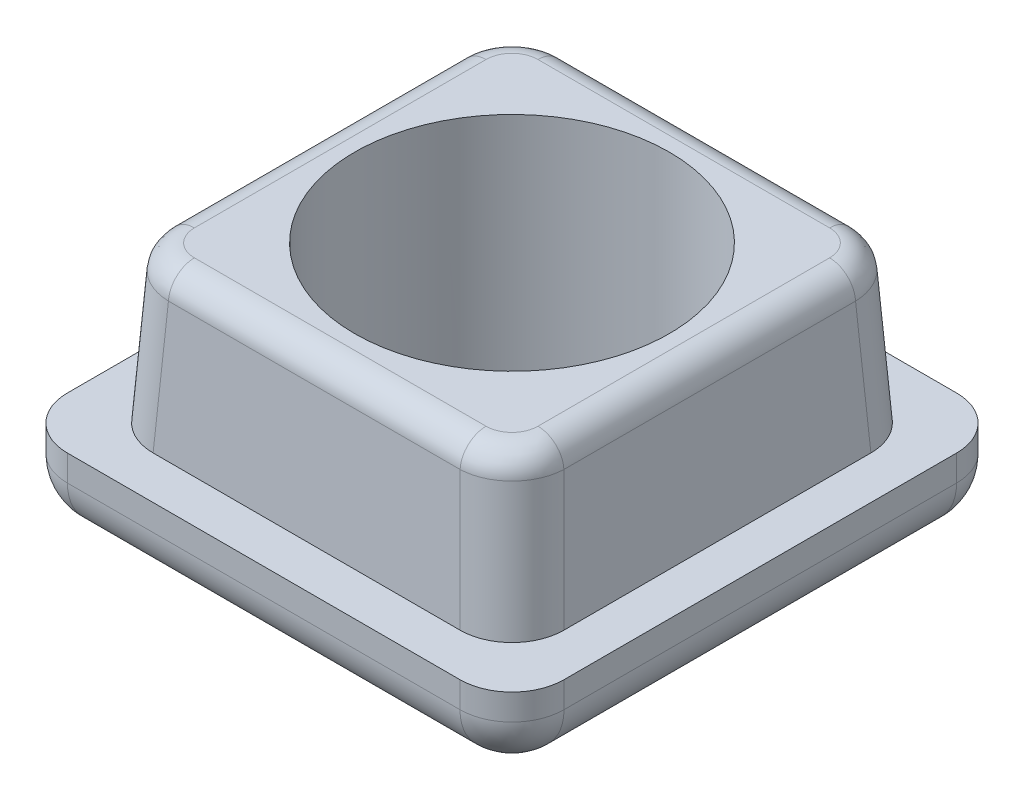
from build123d import *

# Parameters (mm, degrees)
SKETCH1_W           = 19.1
SKETCH1_H           = 19.1
BOSS_EXTRUDE1_DEPTH = 3
SKETCH4_R           = 6.05
CUT_EXTRUDE1_DEPTH  = 29.471389179
FILLET1_R           = 2
FILLET2_R           = 1
FILLET3_R           = 2


with BuildPart() as part:
    # Sketch1 → Boss-Extrude1 (new body)
    with BuildSketch(Plane(origin=(0, 0, 0), x_dir=(1, 0, 0), z_dir=(0, 1, 0))):
        with Locations((9.55, 9.55)):
            Rectangle(SKETCH1_W, SKETCH1_H)
    extrude(amount=BOSS_EXTRUDE1_DEPTH)

    # Sketch2 → Loft1 section 0
    with BuildSketch(Plane(origin=(0, 3, 0), x_dir=(1, 0, 0), z_dir=(0, 1, 0))):
        with BuildLine():
            Line((1.65, 1.65), (17.45, 1.65))
            Line((17.45, 1.65), (17.45, 17.45))
            Line((17.45, 17.45), (1.65, 17.45))
            Line((1.65, 17.45), (1.65, 1.65))
        make_face()
    # Sketch3 → Loft1 section 1
    with BuildSketch(Plane(origin=(0, 9, 0), x_dir=(1, 0, 0), z_dir=(0, 1, 0))):
        with BuildLine():
            Line((2, 2), (17.1, 2))
            Line((17.1, 2), (17.1, 17.1))
            Line((17.1, 17.1), (2, 17.1))
            Line((2, 17.1), (2, 2))
        make_face()
    loft()

    # Sketch4 → Cut-Extrude1 (cut, through all)
    with BuildSketch(Plane.XZ):
        with Locations(Location((9.55, -9.55, 0), (0, 0, 270))):
            Circle(SKETCH4_R)
    extrude(amount=-CUT_EXTRUDE1_DEPTH, mode=Mode.SUBTRACT)

    # Fillet1
    fillet1_edges = [part.edges().sort_by_distance(p)[0] for p in [
        (17.275, 6, -1.825),
        (17.275, 6, -17.275),
        (1.825, 6, -17.275),
        (1.825, 6, -1.825),
        (19.1, 1.5, 0),
        (0, 1.5, 0),
        (19.1, 1.5, -19.1),
        (0, 1.5, -19.1),
    ]]
    fillet(fillet1_edges, radius=FILLET1_R)

    # Fillet2
    fillet2_edges = [part.edges().sort_by_distance(p)[0] for p in [
        (2.584382231, 9, -16.515617769),
        (9.55, 9, -17.1),
        (16.515617769, 9, -16.515617769),
        (17.1, 9, -9.55),
        (16.515617769, 9, -2.584382231),
        (9.55, 9, -2),
        (2.584382231, 9, -2.584382231),
        (2, 9, -9.55),
    ]]
    fillet(fillet2_edges, radius=FILLET2_R)

    # Fillet3
    fillet3_edges = [part.edges().sort_by_distance(p)[0] for p in [
        (19.1, 0, -9.55),
        (0, 0, -9.55),
        (9.55, 0, -19.1),
        (9.55, 0, 0),
        (0.585786438, 0, -18.514213562),
        (18.514213562, 0, -18.514213562),
        (0.585786438, 0, -0.585786438),
        (18.514213562, 0, -0.585786438),
    ]]
    fillet(fillet3_edges, radius=FILLET3_R)


solid = part.part
